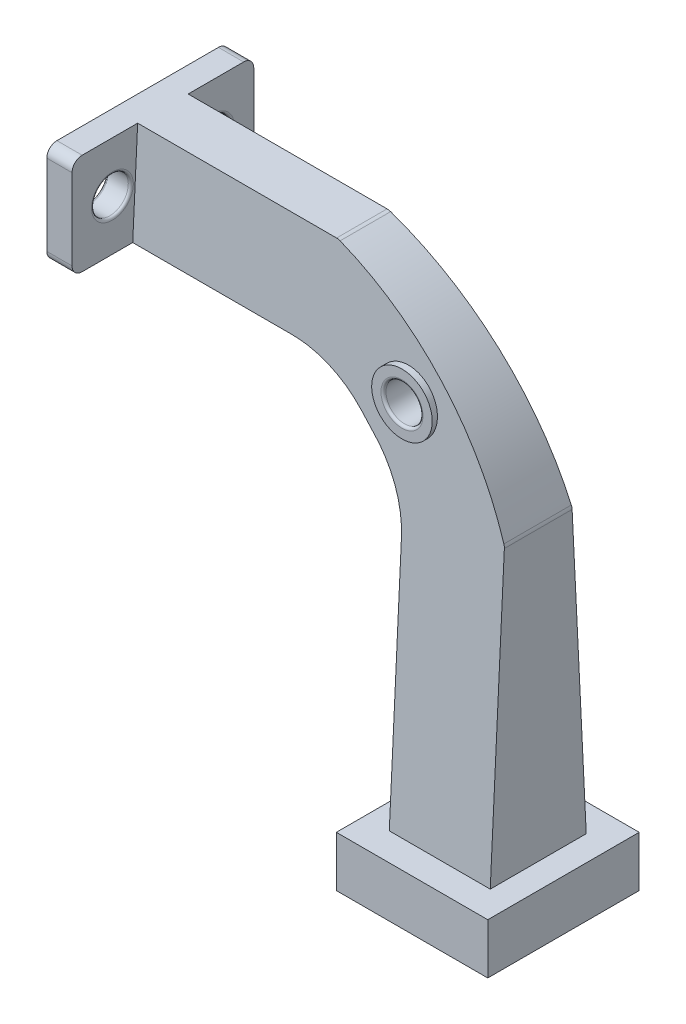
from build123d import *
from build123d.topology import SkipClean

# Parameters (mm, degrees)
BOSS_EXTRUDE1_DEPTH         = 6.35
CUT_EXTRUDE5_START          = -3.175
SKETCH17_OUTSIDE_W          = 31.308
SKETCH17_OUTSIDE_H          = 83.374
CUT_EXTRUDE5_DEPTH          = 59.826542399
BOSS_EXTRUDE7_START         = 6.35
SKETCH18_W                  = 3.175
SKETCH18_H                  = 12.7
BOSS_EXTRUDE7_DEPTH         = 5.08
BOSS_EXTRUDE8_START         = -6.35
SKETCH18_2_W                = 3.175
SKETCH18_2_H                = 12.7
BOSS_EXTRUDE8_DEPTH         = 5.08
CUT_EXTRUDE6_DEPTH          = 46.054038494
CUT_EXTRUDE6_DEPTH_BACK     = 46.054038494
SKETCH20_R                  = 2.3241
FILLET7_R                   = 12.7
FILLET9_R                   = 1.27
SKETCH20_4_R                = 3.81
SKETCH20_4_R_2              = 2.3241
BOSS_EXTRUDE9_DEPTH         = 4.445
FILLET10_R                  = 0.3175
F_14_0_182_DIAMETER_HOLE1_D = 4.6228
FILLET11_R                  = 0.3175
SKETCH23_R                  = 2.3241
CUT_EXTRUDE7_DEPTH          = 12.7
CUT_EXTRUDE8_START          = -6.35
CUT_EXTRUDE8_DEPTH          = 6.604
SKETCH26_W                  = 19.05
SKETCH26_H                  = 19.05
SKETCH26_R                  = 4.249961333
BOSS_EXTRUDE10_DEPTH        = 6.35


with BuildPart() as part:
    # Sketch1 → Boss-Extrude1 (new, symmetric)
    with BuildSketch(Plane.XY):
        with BuildLine():
            Line((12.496873319, -29.207545747), (25.196873319, -29.207545747))
            Line((25.196873319, -29.207545747), (25.196873319, 13.594284672))
            ThreePointArc((25.196873319, 13.594284672), (16.625805495, 26.986477923), (3.233612245, 35.557545747))
            Line((3.233612245, 35.557545747), (-25.196873319, 35.557545747))
            Line((-25.196873319, 35.557545747), (-25.196873319, 22.857545747))
            Line((-25.196873319, 22.857545747), (3.233612245, 22.857545747))
            Line((3.233612245, 22.857545747), (12.496873319, 13.594284672))
            Line((12.496873319, 13.594284672), (12.496873319, -29.207545747))
        make_face()
    extrude(amount=BOSS_EXTRUDE1_DEPTH, both=True)

    # Sketch17 outside → Cut-Extrude5 (cut, through all)
    with BuildSketch(Plane.ZY.offset(25.196873319).offset(CUT_EXTRUDE5_START)):
        with Locations((0, 3.175)):
            Rectangle(SKETCH17_OUTSIDE_W, SKETCH17_OUTSIDE_H)
        Polygon((6.35, -29.207545747), (3.175, 35.557545747), (-3.175, 35.557545747), (-6.35, -29.207545747), align=None, mode=Mode.SUBTRACT)
    extrude(amount=-CUT_EXTRUDE5_DEPTH, mode=Mode.SUBTRACT)

    # Sketch18 → Boss-Extrude7 (add)
    with BuildSketch(Plane.XY.offset(BOSS_EXTRUDE7_START)):
        with Locations((-23.609373319, 29.207545747)):
            Rectangle(SKETCH18_W, SKETCH18_H)
    extrude(amount=BOSS_EXTRUDE7_DEPTH)

    # Sketch18<2> → Boss-Extrude8 (add)
    with BuildSketch(Plane.XY.offset(BOSS_EXTRUDE8_START)):
        with Locations((-23.609373319, 29.207545747)):
            Rectangle(SKETCH18_2_W, SKETCH18_2_H)
    extrude(amount=-BOSS_EXTRUDE8_DEPTH)

    # Sketch20 → Cut-Extrude6 (cut, two sides: drawn at the far end of the back side and taken through both)
    with BuildSketch(Plane.XY.offset(-CUT_EXTRUDE6_DEPTH_BACK)):
        with Locations(Location((12.496873319, 22.857545747, 0), (0, 0, 90))):
            Circle(SKETCH20_R)
    extrude(amount=CUT_EXTRUDE6_DEPTH + CUT_EXTRUDE6_DEPTH_BACK, mode=Mode.SUBTRACT)

    # Fillet7
    fillet7_edges = [part.edges().sort_by_distance(p)[0] for p in [
        (12.496873319, 13.594284672, 0),
        (3.233612245, 22.857545747, 0),
    ]]
    fillet(fillet7_edges, radius=FILLET7_R)

    # Fillet9
    fillet9_edges = [part.edges().sort_by_distance(p)[0] for p in [
        (25.196873319, 13.594284672, 0),
        (3.233612245, 35.557545747, 0),
        (-23.609373319, 22.857545747, 11.43),
        (-23.609373319, 22.857545747, -11.43),
        (-23.609373319, 35.557545747, -11.43),
        (-23.609373319, 35.557545747, 11.43),
    ]]
    fillet(fillet9_edges, radius=FILLET9_R)

    # Sketch20<4> → Boss-Extrude9 (add, symmetric)
    with SkipClean():  # the faces are left unmerged after this step: merging them gives an invalid solid
        with BuildSketch(Plane.XY):
            with Locations(Location((12.496873319, 22.857545747, 0), (0, 0, 90))):
                Circle(SKETCH20_4_R)
            with Locations((12.496873319, 22.857545747)):
                Circle(SKETCH20_4_R_2, mode=Mode.SUBTRACT)
        extrude(amount=BOSS_EXTRUDE9_DEPTH, both=True)

    # Fillet10
    fillet10_edges = [part.edges().sort_by_distance(p)[0] for p in [
        (10.172773319, 22.857545747, -4.445),
        (10.172773319, 22.857545747, 4.445),
    ]]
    fillet(fillet10_edges, radius=FILLET10_R)

    # #14 (0.182) Diameter Hole1 (through all)
    with Locations(Plane.ZY.offset(25.196873319)):
        with Locations((6.35, 29.207545747), (-6.35, 29.207545747)):
            Hole(F_14_0_182_DIAMETER_HOLE1_D / 2)

    # Fillet11
    fillet11_edges = [part.edges().sort_by_distance(p)[0] for p in [
        (-22.021873319, 29.207545747, 8.6614),
        (-25.196873319, 29.207545747, 8.6614),
        (-22.021873319, 29.207545747, -4.0386),
        (-25.196873319, 29.207545747, -4.0386),
    ]]
    fillet(fillet11_edges, radius=FILLET11_R)

    # Sketch23 → Cut-Extrude7 (cut)
    with SkipClean():  # the faces are left unmerged after this step: merging them gives an invalid solid
        with BuildSketch(Plane.XZ.offset(29.207545747)):
            with Locations((18.846873319, 0)):
                Circle(SKETCH23_R)
        extrude(amount=-CUT_EXTRUDE7_DEPTH, mode=Mode.SUBTRACT)

    # Sketch25 → Cut-Extrude8 (cut)
    with SkipClean():  # the faces are left unmerged after this step: merging them gives an invalid solid
        with BuildSketch(Plane.XZ.offset(29.207545747).offset(CUT_EXTRUDE8_START)):
            Polygon((20.679960424, 3.175), (17.013786215, 3.175), (4.682460922, 3.175), (4.682460922, -3.175), (17.013786215, -3.175), (20.679960424, -3.175), (22.513047529, 0), align=None)
        extrude(amount=-CUT_EXTRUDE8_DEPTH, mode=Mode.SUBTRACT)

    # Sketch26 → Boss-Extrude10 (add)
    with SkipClean():  # the faces are left unmerged after this step: merging them gives an invalid solid
        with BuildSketch(Plane.XZ.offset(29.207545747)):
            with Locations((18.846873319, 0)):
                Rectangle(SKETCH26_W, SKETCH26_H)
            with Locations((18.846873319, 0)):
                Circle(SKETCH26_R, mode=Mode.SUBTRACT)
        extrude(amount=-BOSS_EXTRUDE10_DEPTH)


solid = part.part
